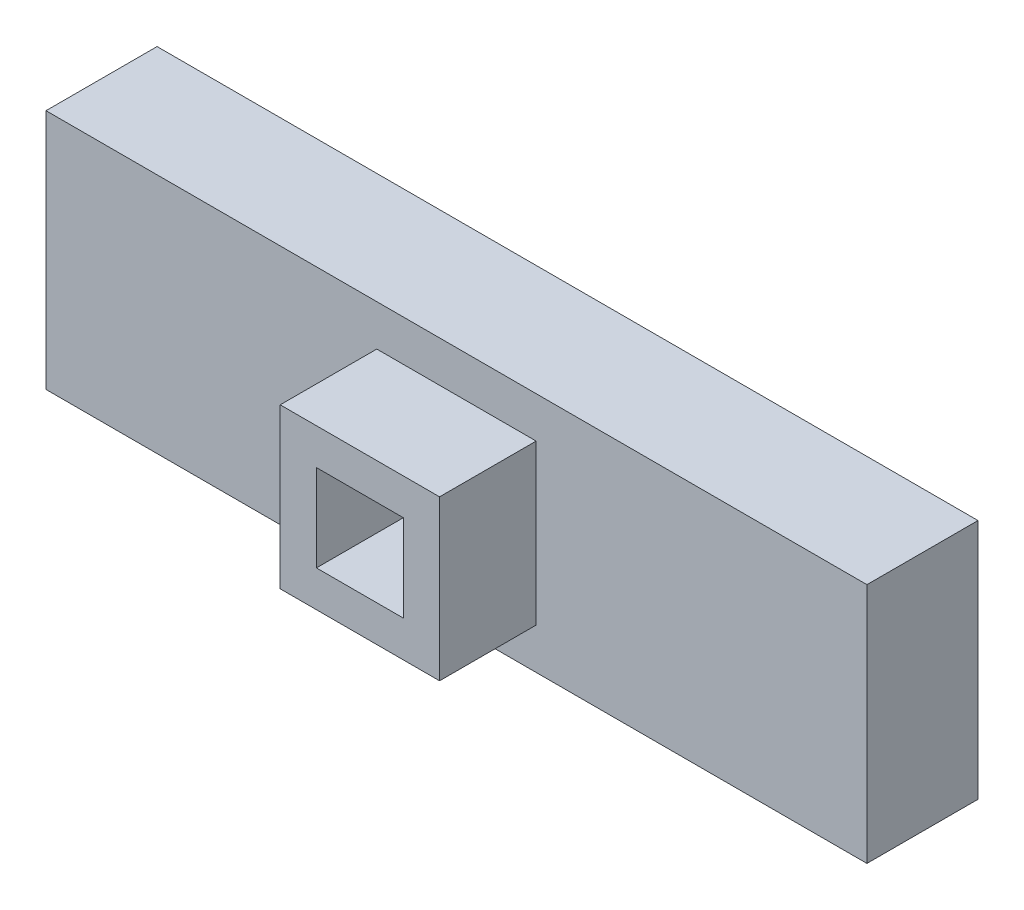
from build123d import *

# Parameters (mm, degrees)
CROQUIS1_W              = 34
CROQUIS1_H              = 10
SALIENTE_EXTRUIR1_DEPTH = 3.6
CROQUIS2_W              = 34
CROQUIS2_H              = 10
SALIENTE_EXTRUIR2_DEPTH = 1
CROQUIS3_W              = 6.6
CROQUIS3_H              = 6.6
CROQUIS3_W_2            = 3.6
CROQUIS3_H_2            = 3.6
SALIENTE_EXTRUIR3_DEPTH = 4


with BuildPart() as part:
    # Croquis1 → Saliente-Extruir1 (new body)
    with BuildSketch(Plane.XY):
        with Locations((-28.217187331, 0.443569554)):
            Rectangle(CROQUIS1_W, CROQUIS1_H)
        with BuildLine():
            Line((-25.840984713, 3.661280093), (-14.217187331, 2.443569554))
            ThreePointArc((-14.217187331, 2.443569554), (-12.217187331, 0.443569554), (-14.217187331, -1.556430446))
            Line((-14.217187331, -1.556430446), (-25.840984713, -2.774140986))
            ThreePointArc((-25.840984713, -2.774140986), (-28.217187331, -3.556430446), (-30.593389949, -2.774140986))
            Line((-30.593389949, -2.774140986), (-42.217187331, -1.556430446))
            ThreePointArc((-42.217187331, -1.556430446), (-44.217187331, 0.443569554), (-42.217187331, 2.443569554))
            Line((-42.217187331, 2.443569554), (-30.593389949, 3.661280093))
            ThreePointArc((-30.593389949, 3.661280093), (-28.217187331, 4.443569554), (-25.840984713, 3.661280093))
        make_face(mode=Mode.SUBTRACT)
    extrude(amount=SALIENTE_EXTRUIR1_DEPTH)

    # Croquis2 → Saliente-Extruir2 (add)
    with BuildSketch(Plane.XY.offset(3.6)):
        with Locations((-28.217187331, 0.443569554)):
            Rectangle(CROQUIS2_W, CROQUIS2_H)
    extrude(amount=SALIENTE_EXTRUIR2_DEPTH)

    # Croquis3 → Saliente-Extruir3 (add)
    with BuildSketch(Plane.XY.offset(4.6)):
        with Locations((-28.217187331, 0.443569554)):
            Rectangle(CROQUIS3_W, CROQUIS3_H)
        with Locations((-28.217187331, 0.443569554)):
            Rectangle(CROQUIS3_W_2, CROQUIS3_H_2, mode=Mode.SUBTRACT)
    extrude(amount=SALIENTE_EXTRUIR3_DEPTH)


solid = part.part
